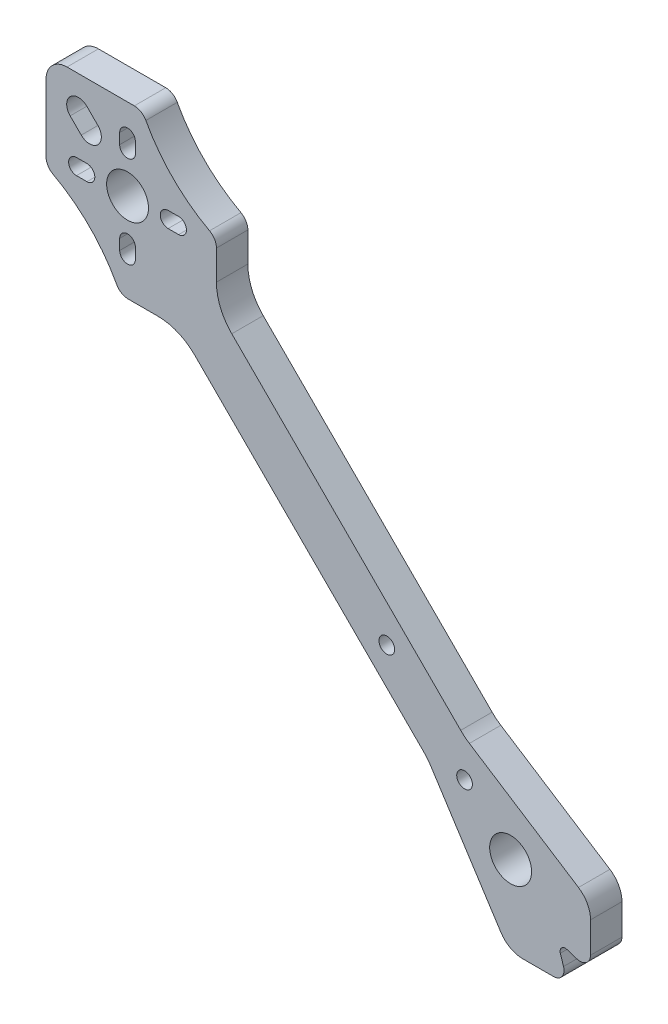
from build123d import *

# Parameters (mm, degrees)
CROQUIS1_R              = 1.5
CROQUIS1_R_2            = 4
SALIENTE_EXTRUIR1_DEPTH = 6
CROQUIS4_R              = 4
SALIENTE_EXTRUIR3_DEPTH = 6
CORTAR_EXTRUIR1_DEPTH   = 6
REDONDEO3_R             = 4
CORTAR_EXTRUIR2_DEPTH   = 6
REDONDEO4_R             = 2.5
REDONDEO6_R             = 10


with BuildPart() as part:
    # Croquis1 → Saliente-Extruir1 (new body)
    with BuildSketch(Plane.XY):
        with BuildLine():
            Line((-17.112213819, 2.294275414), (-30.516043414, 23.123582692))
            ThreePointArc((-30.516043414, 23.123582692), (-31.14080226, 23.989156666), (-31.854269143, 24.783201331))
            Line((-31.854269143, 24.783201331), (-45.961940777, 38.890872965))
            Line((-45.961940777, 38.890872965), (-78.488852712, 71.4177849))
            Line((-78.488852712, 71.4177849), (-71.4177849, 78.488852712))
            Line((-71.4177849, 78.488852712), (-38.890872965, 45.961940777))
            Line((-38.890872965, 45.961940777), (-24.783201331, 31.854269143))
            ThreePointArc((-24.783201331, 31.854269143), (-23.989156666, 31.14080226), (-23.123582692, 30.516043414))
            Line((-23.123582692, 30.516043414), (-2.294275414, 17.112213819))
            ThreePointArc((-2.294275414, 17.112213819), (-0.610887166, 15.302496804), (0, 12.907567049))
            Line((0, 12.907567049), (0, 7.055686841))
            ThreePointArc((0, 7.055686841), (-0.823113423, 5.438609853), (-2.614937985, 5.15257064))
            Line((-2.614937985, 5.15257064), (-4.503911831, 5.762938925))
            ThreePointArc((-4.503911831, 5.762938925), (-5.518487605, 5.518487605), (-5.762938925, 4.503911831))
            Line((-5.762938925, 4.503911831), (-5.15257064, 2.614937985))
            ThreePointArc((-5.15257064, 2.614937985), (-5.438609853, 0.823113423), (-7.055686841, 0))
            Line((-7.055686841, 0), (-12.907567049, 0))
            ThreePointArc((-12.907567049, 0), (-15.302496804, 0.610887166), (-17.112213819, 2.294275414))
        make_face()
        with Locations((-38.890872965, 38.890872965)):
            Circle(CROQUIS1_R, mode=Mode.SUBTRACT)
        with Locations((-24.04163056, 24.04163056)):
            Circle(CROQUIS1_R, mode=Mode.SUBTRACT)
        with Locations((-15.25, 15.25)):
            Circle(CROQUIS1_R_2, mode=Mode.SUBTRACT)
    extrude(amount=SALIENTE_EXTRUIR1_DEPTH)

    # Croquis4 → Saliente-Extruir3 (add)
    with BuildSketch(Plane.XY.offset(6)):
        Polygon((-78.488852712, 71.4177849), (-89.802561211, 71.4177849), (-103.944696834, 85.559920524), (-103.944696834, 103.944696834), (-85.559920524, 103.944696834), (-71.4177849, 89.802561211), (-71.4177849, 78.488852712), align=None)
        with Locations((-88.388347648, 88.388347648)):
            Circle(CROQUIS4_R, mode=Mode.SUBTRACT)
    extrude(amount=-SALIENTE_EXTRUIR3_DEPTH)

    # Croquis5 → Cortar-Extruir1 (cut)
    with BuildSketch(Plane.XY.offset(6)):
        with BuildLine():
            Line((-99.348502757, 96.166522241), (-97.227182413, 94.045201898))
            ThreePointArc((-97.227182413, 94.045201898), (-94.045201898, 94.045201898), (-94.045201898, 97.227182413))
            Line((-94.045201898, 97.227182413), (-96.166522241, 99.348502757))
            ThreePointArc((-96.166522241, 99.348502757), (-99.348502757, 99.348502757), (-99.348502757, 96.166522241))
        make_face()
        with BuildLine():
            Line((-89.888347648, 80.638347648), (-89.888347648, 78.638347648))
            ThreePointArc((-89.888347648, 78.638347648), (-88.388347648, 77.138347648), (-86.888347648, 78.638347648))
            Line((-86.888347648, 78.638347648), (-86.888347648, 80.638347648))
            ThreePointArc((-86.888347648, 80.638347648), (-88.388347648, 82.138347648), (-89.888347648, 80.638347648))
        make_face()
        with BuildLine():
            Line((-80.638347648, 86.888347648), (-78.638347648, 86.888347648))
            ThreePointArc((-78.638347648, 86.888347648), (-77.138347648, 88.388347648), (-78.638347648, 89.888347648))
            Line((-78.638347648, 89.888347648), (-80.638347648, 89.888347648))
            ThreePointArc((-80.638347648, 89.888347648), (-82.138347648, 88.388347648), (-80.638347648, 86.888347648))
        make_face()
        with BuildLine():
            Line((-96.138347648, 89.888347648), (-98.138347648, 89.888347648))
            ThreePointArc((-98.138347648, 89.888347648), (-99.638347648, 88.388347648), (-98.138347648, 86.888347648))
            Line((-98.138347648, 86.888347648), (-96.138347648, 86.888347648))
            ThreePointArc((-96.138347648, 86.888347648), (-94.638347648, 88.388347648), (-96.138347648, 89.888347648))
        make_face()
        with BuildLine():
            Line((-86.888347648, 96.138347648), (-86.888347648, 98.138347648))
            ThreePointArc((-86.888347648, 98.138347648), (-88.388347648, 99.638347648), (-89.888347648, 98.138347648))
            Line((-89.888347648, 98.138347648), (-89.888347648, 96.138347648))
            ThreePointArc((-89.888347648, 96.138347648), (-88.388347648, 94.638347648), (-86.888347648, 96.138347648))
        make_face()
    extrude(amount=-CORTAR_EXTRUIR1_DEPTH, mode=Mode.SUBTRACT)

    # Redondeo3
    redondeo3_edges = [part.edges().sort_by_distance(p)[0] for p in [
        (-103.944696834, 103.944696834, 3),
    ]]
    fillet(redondeo3_edges, radius=REDONDEO3_R)

    # Croquis7 → Cortar-Extruir2 (cut)
    with BuildSketch(Plane.XY.offset(6)):
        with BuildLine():
            Line((-103.944696834, 85.559920524), (-89.802561211, 71.4177849))
            ThreePointArc((-89.802561211, 71.4177849), (-95.660425587, 79.702056147), (-103.944696834, 85.559920524))
        make_face()
        with BuildLine():
            Line((-85.559920524, 103.944696834), (-71.4177849, 89.802561211))
            ThreePointArc((-71.4177849, 89.802561211), (-79.702056147, 95.660425587), (-85.559920524, 103.944696834))
        make_face()
    extrude(amount=-CORTAR_EXTRUIR2_DEPTH, mode=Mode.SUBTRACT)

    # Redondeo4
    redondeo4_edges = [part.edges().sort_by_distance(p)[0] for p in [
        (-89.802561211, 71.4177849, 3),
        (-103.944696834, 85.559920524, 3),
        (-85.559920524, 103.944696834, 3),
        (-71.4177849, 89.802561211, 3),
    ]]
    fillet(redondeo4_edges, radius=REDONDEO4_R)

    # Redondeo6
    redondeo6_edges = [part.edges().sort_by_distance(p)[0] for p in [
        (-78.488852712, 71.4177849, 3),
        (-71.4177849, 78.488852712, 3),
    ]]
    fillet(redondeo6_edges, radius=REDONDEO6_R)


solid = part.part
